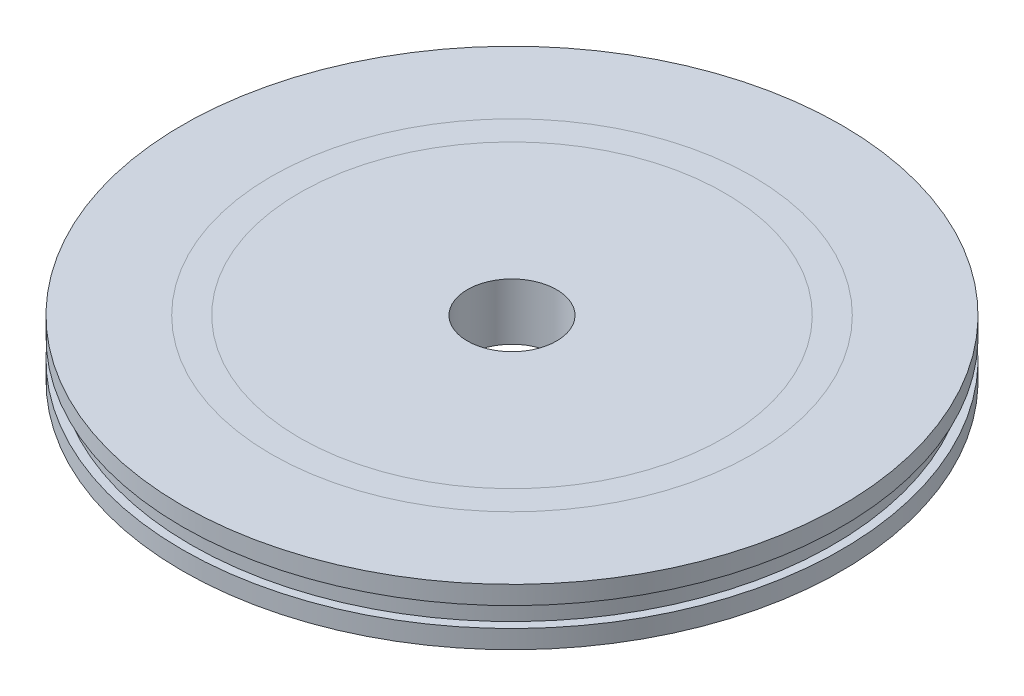
from build123d import *

# Parameters (mm, degrees)
F_8_0MM_DOWEL_HOLE1_D = 8


with BuildPart() as part:
    # Sketch1 → Revolve1 (revolve)
    with BuildSketch(Plane(origin=(0, 0, 0), x_dir=(0, 0, -1), z_dir=(1, 0, 0))):
        Polygon((0, 0), (0, -5.08), (-29.5656, -5.08), (-29.5656, -3.429), (-28.8036, -3.429), (-28.8036, -1.651), (-29.5656, -1.651), (-29.5656, 0), align=None)
    revolve(axis=Axis((0, 0, 0), (0, -1, 0)))

    # Ø8.0mm Dowel Hole1 (through all)
    with Locations(Plane(origin=(0, 0, 0), x_dir=(1, 0, 0), z_dir=(0, 1, 0))):
        with Locations((0, 0)):
            Hole(F_8_0MM_DOWEL_HOLE1_D / 2)


solid = part.part
